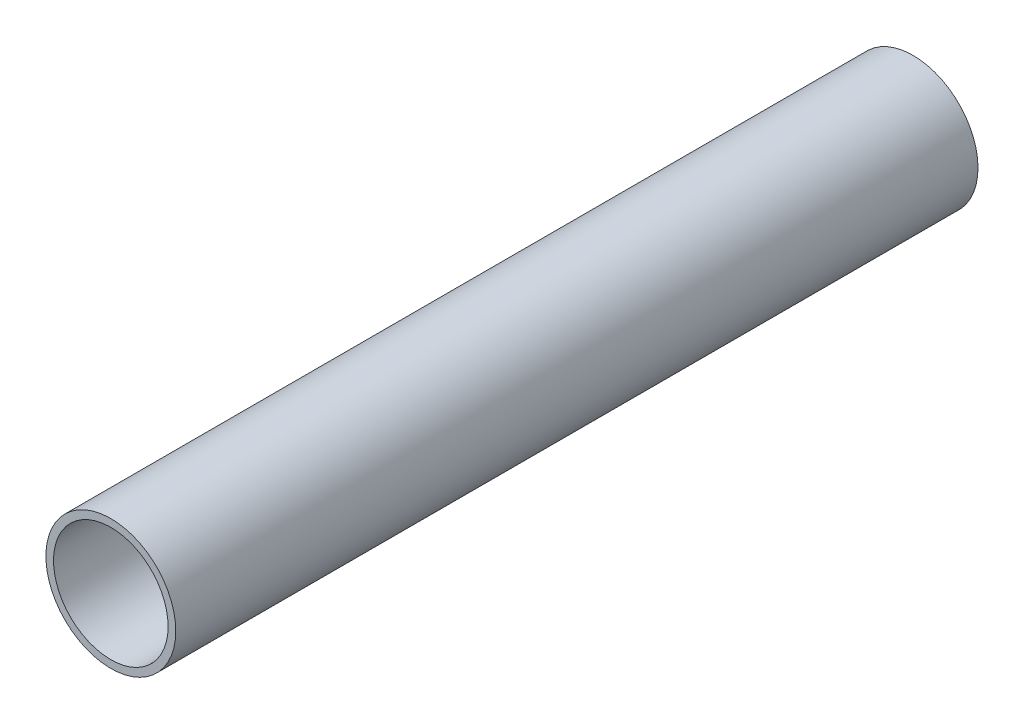
from build123d import *

# Parameters (mm, degrees)
SKETCH1_R           = 17
SKETCH1_R_2         = 15
BOSS_EXTRUDE1_DEPTH = 105


with BuildPart() as part:
    # Sketch1 → Boss-Extrude1 (new, symmetric)
    with BuildSketch(Plane.XY):
        Circle(SKETCH1_R)
        Circle(SKETCH1_R_2, mode=Mode.SUBTRACT)
    extrude(amount=BOSS_EXTRUDE1_DEPTH, both=True)


solid = part.part
